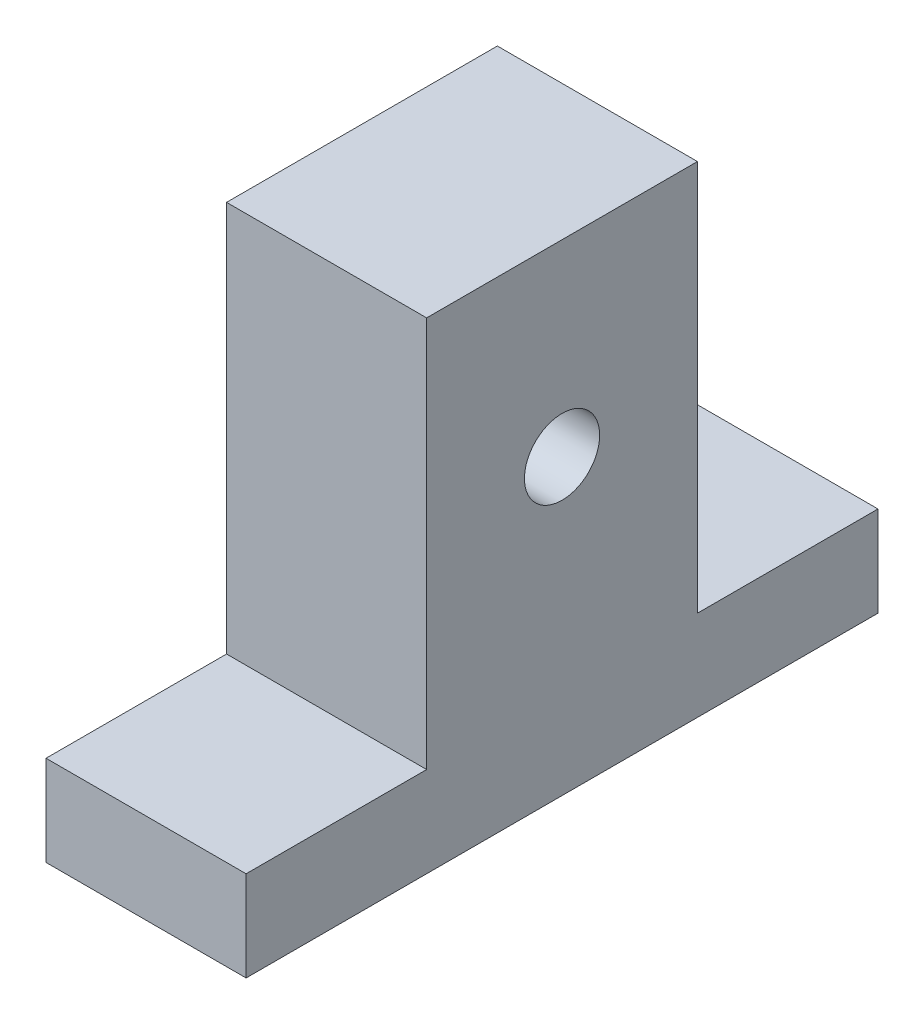
from build123d import *

# Parameters (mm, degrees)
SKETCH_1_R      = 2.5
EXTRUDE_1_DEPTH = 13.3


with BuildPart() as part:
    # 草图1 → 凸台-拉伸1 (new body)
    with BuildSketch(Plane(origin=(0, 0, 0), x_dir=(0, 0, -1), z_dir=(1, 0, 0))):
        Polygon((-73.839514953, -90.434627318), (-31.839514953, -90.434627318), (-31.839514953, -84.434627318), (-43.839514953, -84.434627318), (-43.839514953, -58.434627318), (-61.839514953, -58.434627318), (-61.839514953, -84.434627318), (-73.839514953, -84.434627318), align=None)
        with Locations((-52.839514953, -70.934627318)):
            Circle(SKETCH_1_R, mode=Mode.SUBTRACT)
    extrude(amount=EXTRUDE_1_DEPTH)


solid = part.part
